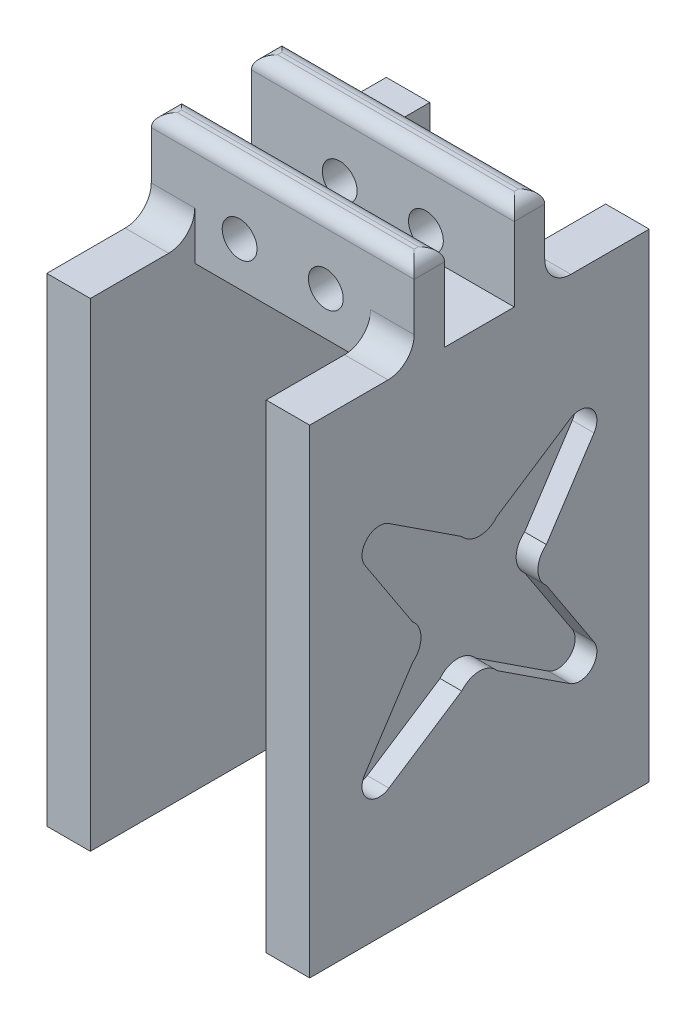
from build123d import *

# Parameters (mm, degrees)
BOSS_EXTRUDE1_DEPTH = 15.1
SKETCH2_W           = 20.2
SKETCH2_H           = 52.5
CUT_EXTRUDE1_DEPTH  = 39
SKETCH3_W           = 20.2
SKETCH3_H           = 12
CUT_EXTRUDE2_DEPTH  = 2.5
FILLET1_R           = 3
FILLET2_R           = 1.5
CUT_EXTRUDE3_REACH  = 50.613
SKETCH4_R           = 2
CUT_EXTRUDE4_DEPTH  = 2.5
CUT_EXTRUDE5_START  = -2.5
CUT_EXTRUDE5_DEPTH  = 2.5


with BuildPart() as part:
    # Sketch1 → Boss-Extrude1 (new, symmetric)
    with BuildSketch(Plane(origin=(0, 0, 0), x_dir=(0, 0, -1), z_dir=(1, 0, 0))):
        Polygon((-19.5, -27.5), (19.5, -27.5), (19.5, 27.5), (7.5, 27.5), (7.5, 37.5), (4, 37.5), (4, 27.5), (-4, 27.5), (-4, 37.5), (-7.5, 37.5), (-7.5, 27.5), (-19.5, 27.5), align=None)
    extrude(amount=BOSS_EXTRUDE1_DEPTH, both=True)

    # Sketch2 → Cut-Extrude1 (cut)
    with BuildSketch(Plane.XY.offset(19.5)):
        with Locations((0, -1.25)):
            Rectangle(SKETCH2_W, SKETCH2_H)
    extrude(amount=-CUT_EXTRUDE1_DEPTH, mode=Mode.SUBTRACT)

    # Sketch3 → Cut-Extrude2 (cut)
    with BuildSketch(Plane(origin=(0, 27.5, 0), x_dir=(1, 0, 0), z_dir=(0, 1, 0))):
        with Locations((0, -13.5)):
            Rectangle(SKETCH3_W, SKETCH3_H)
        with Locations((0, 13.5)):
            Rectangle(SKETCH3_W, SKETCH3_H)
    extrude(amount=-CUT_EXTRUDE2_DEPTH, mode=Mode.SUBTRACT)

    # Fillet1
    fillet1_edges = [part.edges().sort_by_distance(p)[0] for p in [
        (12.6, 27.5, 7.5),
        (12.6, 27.5, -7.5),
        (-12.6, 27.5, 7.5),
        (-12.6, 27.5, -7.5),
    ]]
    fillet(fillet1_edges, radius=FILLET1_R)

    # Fillet2
    fillet2_edges = [part.edges().sort_by_distance(p)[0] for p in [
        (15.1, 37.5, -5.75),
        (-15.1, 37.5, 5.75),
        (-15.1, 37.5, -5.75),
        (0, 37.5, 7.5),
        (0, 37.5, 4),
        (0, 37.5, -4),
        (0, 37.5, -7.5),
        (15.1, 37.5, 5.75),
    ]]
    fillet(fillet2_edges, radius=FILLET2_R)

    # Cut-Extrude3: up to this face of the body (flat: up to its plane)
    cut_extrude3_end = Plane(part.part.faces().sort_by_distance((0, 31.045634921, -7.5))[0])
    # Sketch4 → Cut-Extrude3 (cut, up to the picked face)
    with BuildSketch(Plane.XY.offset(7.5), mode=Mode.PRIVATE) as cut_extrude3_sk1:
        with Locations((-4.95, 30)):
            Circle(SKETCH4_R)
    cut_extrude3_tool1 = split(extrude(cut_extrude3_sk1.sketch, amount=-CUT_EXTRUDE3_REACH, mode=Mode.PRIVATE), bisect_by=cut_extrude3_end, keep=Keep.BOTH, mode=Mode.PRIVATE)
    # Sketch4 → Cut-Extrude3 (cut, up to the picked face)
    with BuildSketch(Plane.XY.offset(7.5), mode=Mode.PRIVATE) as cut_extrude3_sk2:
        with Locations(Location((4.95, 30, 0), (0, 0, 270))):
            Circle(SKETCH4_R)
    cut_extrude3_tool2 = split(extrude(cut_extrude3_sk2.sketch, amount=-CUT_EXTRUDE3_REACH, mode=Mode.PRIVATE), bisect_by=cut_extrude3_end, keep=Keep.BOTH, mode=Mode.PRIVATE)
    add(cut_extrude3_tool1.solids().sort_by(Axis((-4.95, 30, 7.5), (0, 0, -1)))[0], mode=Mode.SUBTRACT)
    add(cut_extrude3_tool2.solids().sort_by(Axis((4.95, 30, 7.5), (0, 0, -1)))[0], mode=Mode.SUBTRACT)

    # Sketch5 → Cut-Extrude4 (cut)
    with BuildSketch(Plane(origin=(15.1, 0, 0), x_dir=(0, 0, -1), z_dir=(1, 0, 0))):
        with BuildLine():
            Line((13.163699082, 10.394877926), (7.685662738, 2.028808489))
            ThreePointArc((7.685662738, 2.028808489), (6.717514421, 0), (7.685662738, -2.028808489))
            Line((7.685662738, -2.028808489), (13.163699082, -10.394877926))
            ThreePointArc((13.163699082, -10.394877926), (12.904698757, -12.904698757), (10.394877926, -13.163699082))
            Line((10.394877926, -13.163699082), (2.028808489, -7.685662738))
            ThreePointArc((2.028808489, -7.685662738), (0, -6.717514421), (-2.028808489, -7.685662738))
            Line((-2.028808489, -7.685662738), (-10.394877926, -13.163699082))
            ThreePointArc((-10.394877926, -13.163699082), (-12.904698757, -12.904698757), (-13.163699082, -10.394877926))
            Line((-13.163699082, -10.394877926), (-7.685662738, -2.028808489))
            ThreePointArc((-7.685662738, -2.028808489), (-6.717514421, 0), (-7.685662738, 2.028808489))
            Line((-7.685662738, 2.028808489), (-13.163699082, 10.394877926))
            ThreePointArc((-13.163699082, 10.394877926), (-12.904698757, 12.904698757), (-10.394877926, 13.163699082))
            Line((-10.394877926, 13.163699082), (-2.028808489, 7.685662738))
            ThreePointArc((-2.028808489, 7.685662738), (0, 6.717514421), (2.028808489, 7.685662738))
            Line((2.028808489, 7.685662738), (10.394877926, 13.163699082))
            ThreePointArc((10.394877926, 13.163699082), (12.904698757, 12.904698757), (13.163699082, 10.394877926))
        make_face()
    extrude(amount=-CUT_EXTRUDE4_DEPTH, mode=Mode.SUBTRACT)

    # Sketch6 → Cut-Extrude5 (cut)
    with BuildSketch(Plane.ZY.offset(15.1).offset(CUT_EXTRUDE5_START)):
        with BuildLine():
            Line((13.163699082, 10.394877926), (7.685662738, 2.028808489))
            ThreePointArc((7.685662738, 2.028808489), (6.717514421, 0), (7.685662738, -2.028808489))
            Line((7.685662738, -2.028808489), (13.163699082, -10.394877926))
            ThreePointArc((13.163699082, -10.394877926), (12.904698757, -12.904698757), (10.394877926, -13.163699082))
            Line((10.394877926, -13.163699082), (2.028808489, -7.685662738))
            ThreePointArc((2.028808489, -7.685662738), (0, -6.717514421), (-2.028808489, -7.685662738))
            Line((-2.028808489, -7.685662738), (-10.394877926, -13.163699082))
            ThreePointArc((-10.394877926, -13.163699082), (-12.904698757, -12.904698757), (-13.163699082, -10.394877926))
            Line((-13.163699082, -10.394877926), (-7.685662738, -2.028808489))
            ThreePointArc((-7.685662738, -2.028808489), (-6.717514421, 0), (-7.685662738, 2.028808489))
            Line((-7.685662738, 2.028808489), (-13.163699082, 10.394877926))
            ThreePointArc((-13.163699082, 10.394877926), (-12.904698757, 12.904698757), (-10.394877926, 13.163699082))
            Line((-10.394877926, 13.163699082), (-2.028808489, 7.685662738))
            ThreePointArc((-2.028808489, 7.685662738), (0, 6.717514421), (2.028808489, 7.685662738))
            Line((2.028808489, 7.685662738), (10.394877926, 13.163699082))
            ThreePointArc((10.394877926, 13.163699082), (12.904698757, 12.904698757), (13.163699082, 10.394877926))
        make_face()
    extrude(amount=CUT_EXTRUDE5_DEPTH, mode=Mode.SUBTRACT)


solid = part.part
